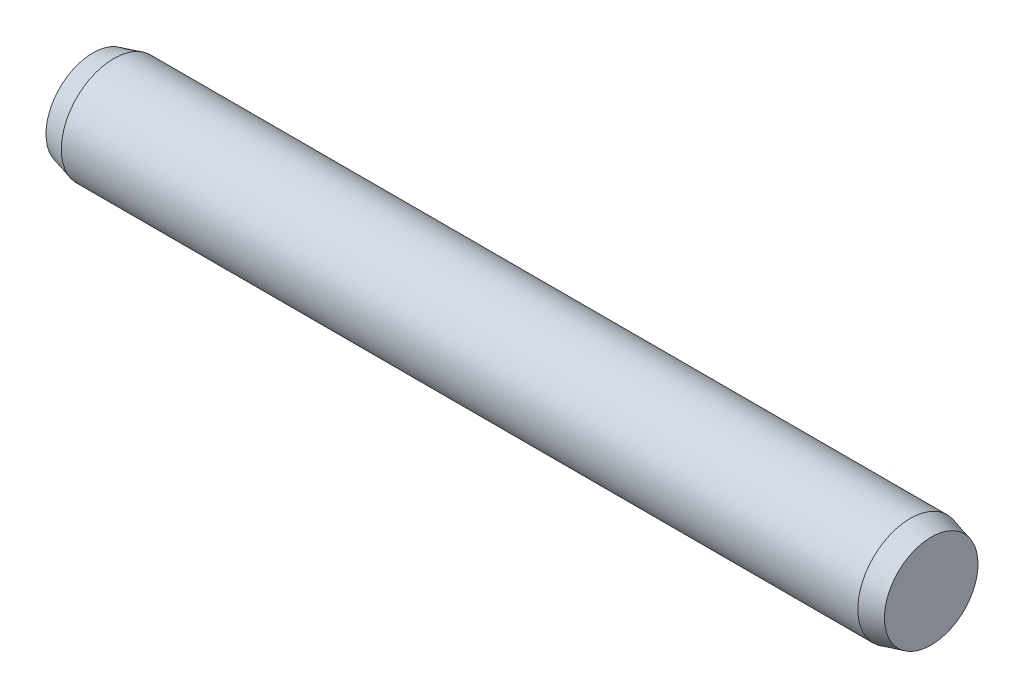
from build123d import *

# Parameters (mm, degrees)
EXTRUDE1_DEPTH      = 5.7
EXTRUDE1_DEPTH_BACK = 5.7
SKETCH2_R           = 0.75
SKETCH3_R           = 0.75
EXTRUDE2_DEPTH      = 0.3
EXTRUDE2_TAPER      = 15
SKETCH4_R           = 0.75
EXTRUDE3_DEPTH      = 0.3
EXTRUDE3_TAPER      = 15


with BuildPart() as part:
    # Sketch2 → Extrude1 (new, two sides: drawn at the far end of the back side and taken through both)
    with BuildSketch(Plane(origin=(0, 0, 0), x_dir=(0, 0, -1), z_dir=(1, 0, 0)).offset(-EXTRUDE1_DEPTH_BACK)):
        Circle(SKETCH2_R)
    extrude(amount=EXTRUDE1_DEPTH + EXTRUDE1_DEPTH_BACK)

    # Sketch3 → Extrude2 (add)
    with BuildSketch(Plane(origin=(5.7, 0, 0), x_dir=(0, 0, -1), z_dir=(1, 0, 0))):
        Circle(SKETCH3_R)
    extrude(amount=EXTRUDE2_DEPTH, taper=EXTRUDE2_TAPER)

    # Sketch4 → Extrude3 (add)
    with BuildSketch(Plane.ZY.offset(5.7)):
        with Locations(Location((0, 0, 0), (0, 0, 180))):
            Circle(SKETCH4_R)
    extrude(amount=EXTRUDE3_DEPTH, taper=EXTRUDE3_TAPER)


solid = part.part
